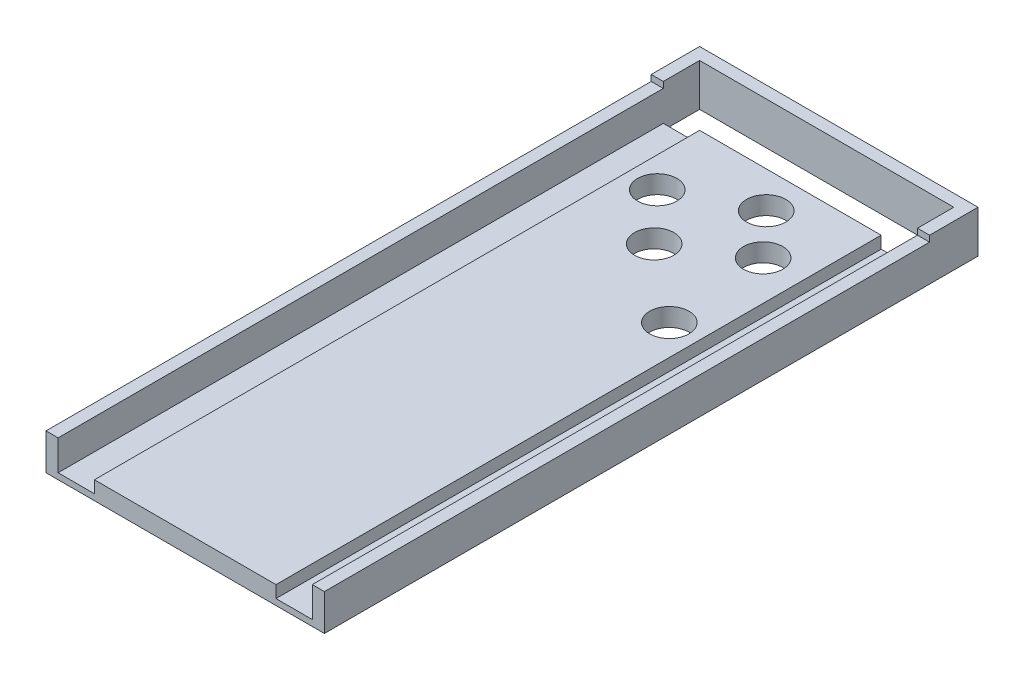
from build123d import *

# Parameters (mm, degrees)
SKETCH1_W           = 0.3
SKETCH1_H           = 1
BOSS_EXTRUDE2_DEPTH = 0.03
SKETCH1_6_W         = 0.06
SKETCH1_6_H         = 1
BOSS_EXTRUDE3_DEPTH = 0.01
SKETCH1_7_W         = 0.02
SKETCH1_7_H         = 1
BOSS_EXTRUDE4_DEPTH = 0.06
SKETCH3_W           = 0.46
SKETCH3_H           = 0.08
BOSS_EXTRUDE7_DEPTH = 0.07
CUT_EXTRUDE1_REACH  = 3.147
SKETCH6_W           = 0.42
SKETCH6_H           = 0.06
CUT_EXTRUDE2_REACH  = 3.146
SKETCH7_R           = 0.0325


with BuildPart() as part:
    # Sketch1 → Boss-Extrude2 (new body)
    with BuildSketch(Plane(origin=(0, 0, 0), x_dir=(1, 0, 0), z_dir=(0, 1, 0))):
        with Locations((0.15, 0.5)):
            Rectangle(SKETCH1_W, SKETCH1_H)
    extrude(amount=BOSS_EXTRUDE2_DEPTH)

    # Sketch1<6> → Boss-Extrude3 (add)
    with BuildSketch(Plane(origin=(0, 0, 0), x_dir=(1, 0, 0), z_dir=(0, 1, 0))):
        with Locations((-0.03, 0.5)):
            Rectangle(SKETCH1_6_W, SKETCH1_6_H)
        with Locations((0.33, 0.5)):
            Rectangle(SKETCH1_6_W, SKETCH1_6_H)
    extrude(amount=BOSS_EXTRUDE3_DEPTH)

    # Sketch1<7> → Boss-Extrude4 (add)
    with BuildSketch(Plane(origin=(0, 0, 0), x_dir=(1, 0, 0), z_dir=(0, 1, 0))):
        with Locations((-0.07, 0.5)):
            Rectangle(SKETCH1_7_W, SKETCH1_7_H)
        with Locations((0.37, 0.5)):
            Rectangle(SKETCH1_7_W, SKETCH1_7_H)
    extrude(amount=BOSS_EXTRUDE4_DEPTH)

    # Sketch3 → Boss-Extrude7 (add)
    with BuildSketch(Plane(origin=(0, 0, 0), x_dir=(1, 0, 0), z_dir=(0, 1, 0))):
        with Locations((0.15, 1.04)):
            Rectangle(SKETCH3_W, SKETCH3_H)
    extrude(amount=BOSS_EXTRUDE7_DEPTH)

    # Sketch6 → Cut-Extrude1 (cut, up to next)
    with BuildSketch(Plane(origin=(0, 0.07, 0), x_dir=(1, 0, 0), z_dir=(0, 1, 0)), mode=Mode.PRIVATE) as cut_extrude1_sk1:
        with Locations((0.15, 1.03)):
            Rectangle(SKETCH6_W, SKETCH6_H)
    cut_extrude1_tool1 = extrude(cut_extrude1_sk1.sketch, amount=-CUT_EXTRUDE1_REACH, mode=Mode.PRIVATE) & part.part
    add(cut_extrude1_tool1.solids().sort_by_distance((0.15, 0.07, -1.03))[0], mode=Mode.SUBTRACT)

    # Sketch7 → Cut-Extrude2 (cut, up to next)
    with BuildSketch(Plane(origin=(0, 0.03, 0), x_dir=(1, 0, 0), z_dir=(0, 1, 0)), mode=Mode.PRIVATE) as cut_extrude2_sk1:
        with Locations((0.05, 0.88)):
            Circle(SKETCH7_R)
    cut_extrude2_tool1 = extrude(cut_extrude2_sk1.sketch, amount=-CUT_EXTRUDE2_REACH, mode=Mode.PRIVATE) & part.part
    # Sketch7 → Cut-Extrude2 (cut, up to next)
    with BuildSketch(Plane(origin=(0, 0.03, 0), x_dir=(1, 0, 0), z_dir=(0, 1, 0)), mode=Mode.PRIVATE) as cut_extrude2_sk2:
        with Locations((0.125, 0.8)):
            Circle(SKETCH7_R)
    cut_extrude2_tool2 = extrude(cut_extrude2_sk2.sketch, amount=-CUT_EXTRUDE2_REACH, mode=Mode.PRIVATE) & part.part
    # Sketch7 → Cut-Extrude2 (cut, up to next)
    with BuildSketch(Plane(origin=(0, 0.03, 0), x_dir=(1, 0, 0), z_dir=(0, 1, 0)), mode=Mode.PRIVATE) as cut_extrude2_sk3:
        with Locations((0.235, 0.87)):
            Circle(SKETCH7_R)
    cut_extrude2_tool3 = extrude(cut_extrude2_sk3.sketch, amount=-CUT_EXTRUDE2_REACH, mode=Mode.PRIVATE) & part.part
    # Sketch7 → Cut-Extrude2 (cut, up to next)
    with BuildSketch(Plane(origin=(0, 0.03, 0), x_dir=(1, 0, 0), z_dir=(0, 1, 0)), mode=Mode.PRIVATE) as cut_extrude2_sk4:
        with Locations((0.17, 0.94)):
            Circle(SKETCH7_R)
    cut_extrude2_tool4 = extrude(cut_extrude2_sk4.sketch, amount=-CUT_EXTRUDE2_REACH, mode=Mode.PRIVATE) & part.part
    # Sketch7 → Cut-Extrude2 (cut, up to next)
    with BuildSketch(Plane(origin=(0, 0.03, 0), x_dir=(1, 0, 0), z_dir=(0, 1, 0)), mode=Mode.PRIVATE) as cut_extrude2_sk5:
        with Locations((0.25, 0.7)):
            Circle(SKETCH7_R)
    cut_extrude2_tool5 = extrude(cut_extrude2_sk5.sketch, amount=-CUT_EXTRUDE2_REACH, mode=Mode.PRIVATE) & part.part
    add(cut_extrude2_tool1.solids().sort_by_distance((0.05, 0.03, -0.88))[0], mode=Mode.SUBTRACT)
    add(cut_extrude2_tool2.solids().sort_by_distance((0.125, 0.03, -0.8))[0], mode=Mode.SUBTRACT)
    add(cut_extrude2_tool3.solids().sort_by_distance((0.235, 0.03, -0.87))[0], mode=Mode.SUBTRACT)
    add(cut_extrude2_tool4.solids().sort_by_distance((0.17, 0.03, -0.94))[0], mode=Mode.SUBTRACT)
    add(cut_extrude2_tool5.solids().sort_by_distance((0.25, 0.03, -0.7))[0], mode=Mode.SUBTRACT)


solid = part.part
